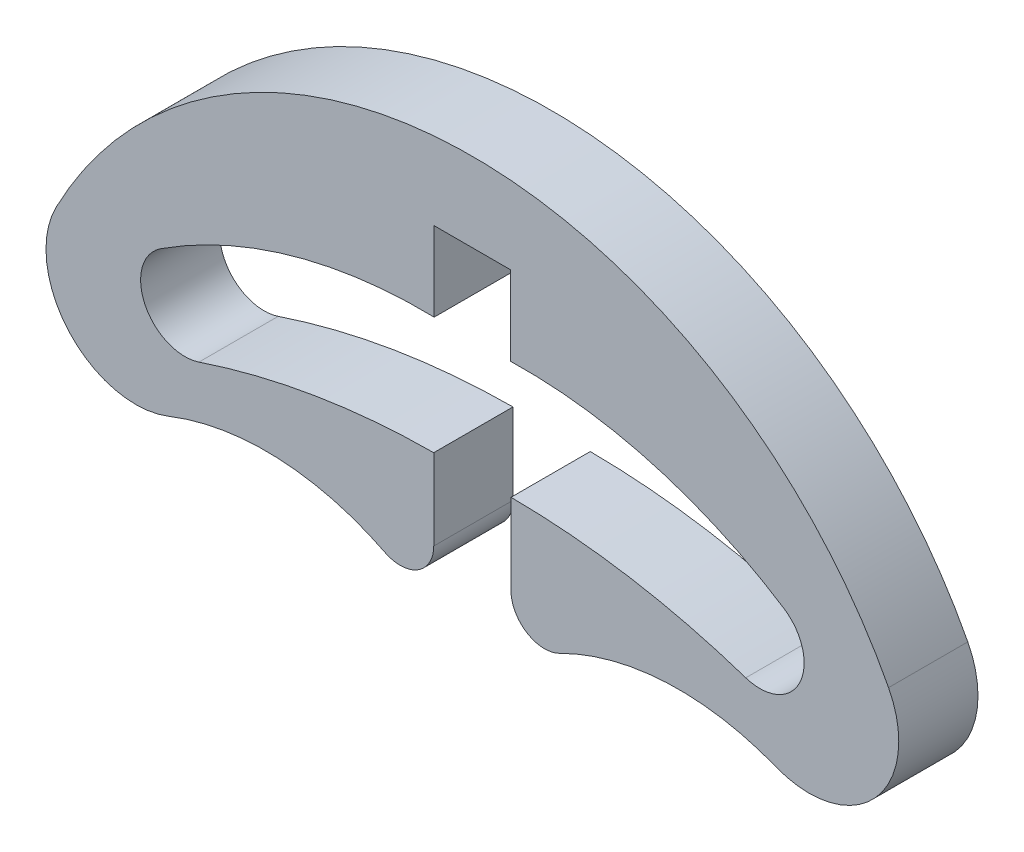
from build123d import *

# Parameters (mm, degrees)
EXTRUDE_1_DEPTH     = 3
SKETCH_2_W          = 2.925
SKETCH_2_H          = 8.058162309
CUT_EXTRUDE_1_DEPTH = 3
FILLET_1_R          = 1.27


with BuildPart() as part:
    # 스케치1 → 보스-돌출1 (new body)
    with BuildSketch(Plane.XY):
        with BuildLine():
            Line((-1.4475, 2.128), (-1.4475, 5.128))
            Line((-1.4475, 5.128), (1.4475, 5.128))
            Line((1.4475, 5.128), (1.4475, 2.128))
            ThreePointArc((1.4475, 2.128), (6.843352857, 1.44491364), (11.796869597, -0.801084345))
            ThreePointArc((11.796869597, -0.801084345), (12.394248626, -2.935784128), (10.351605925, -3.7968391))
            ThreePointArc((10.351605925, -3.7968391), (5.891355798, -2.693189603), (1.311601441, -2.322078509))
            Line((1.311601441, -2.322078509), (1.311601441, -7.845124291))
            ThreePointArc((1.311601441, -7.845124291), (6.16890602, -5.580674334), (11.498183086, -6.146313204))
            ThreePointArc((11.498183086, -6.146313204), (15.270849943, -5.260819217), (15.756720066, -1.416206748))
            ThreePointArc((15.756720066, -1.416206748), (9.210946066, 5.555889316), (0, 8.128))
            ThreePointArc((0, 8.128), (-9.210946066, 5.555889316), (-15.756720066, -1.416206748))
            ThreePointArc((-15.756720066, -1.416206748), (-15.270849943, -5.260819217), (-11.498183086, -6.146313204))
            ThreePointArc((-11.498183086, -6.146313204), (-6.16890602, -5.580674334), (-1.311601441, -7.845124291))
            Line((-1.311601441, -7.845124291), (-1.311601441, -2.322078509))
            ThreePointArc((-1.311601441, -2.322078509), (-5.891355798, -2.693189603), (-10.351605925, -3.7968391))
            ThreePointArc((-10.351605925, -3.7968391), (-12.394248626, -2.935784128), (-11.796869597, -0.801084345))
            ThreePointArc((-11.796869597, -0.801084345), (-6.843352857, 1.44491364), (-1.4475, 2.128))
        make_face()
    extrude(amount=EXTRUDE_1_DEPTH)

    # 스케치2 → 컷-돌출1 (cut)
    with BuildSketch(Plane.XY.offset(3)):
        with Locations((0, -5.233231355)):
            Rectangle(SKETCH_2_W, SKETCH_2_H)
    extrude(amount=-CUT_EXTRUDE_1_DEPTH, mode=Mode.SUBTRACT)

    # 필렛1
    fillet_1_edges = [part.edges().sort_by_distance(p)[0] for p in [
        (1.4625, -7.718694121, 1.5),
        (-1.4625, -7.718694121, 1.5),
    ]]
    fillet(fillet_1_edges, radius=FILLET_1_R)


solid = part.part
